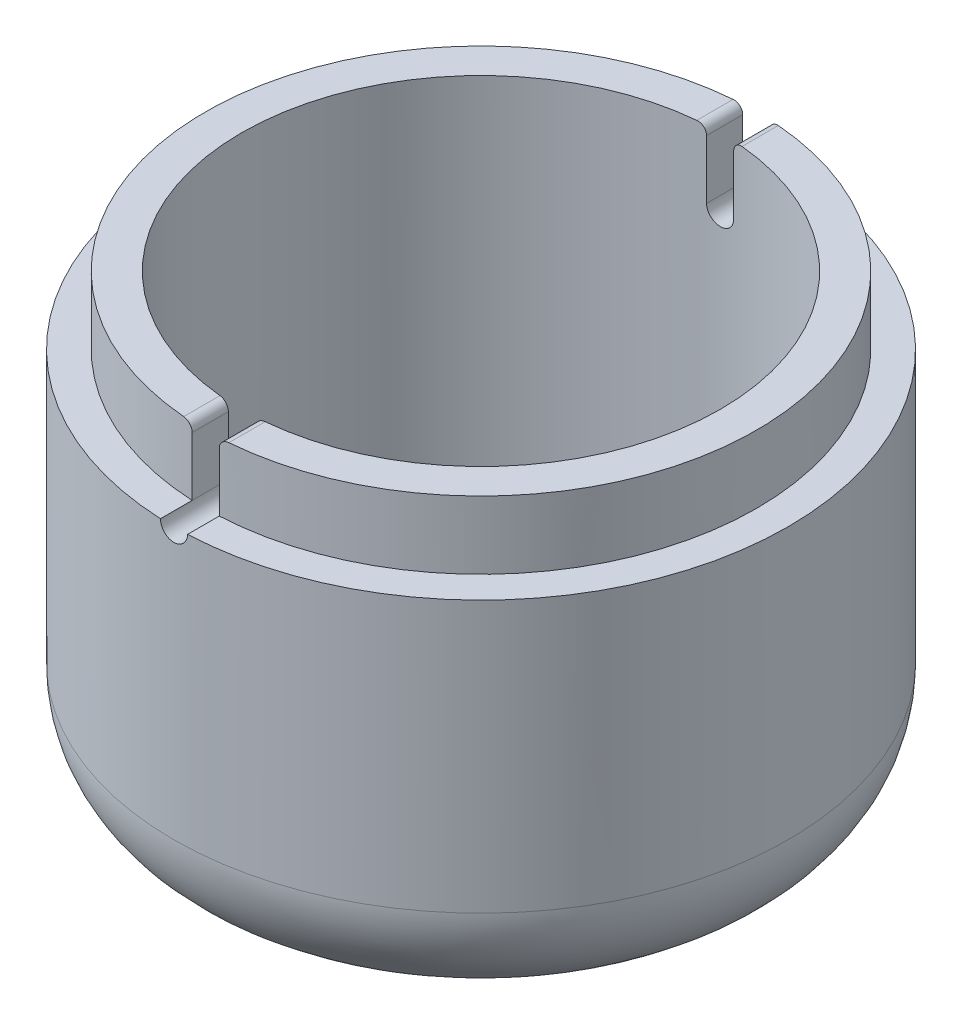
from build123d import *

# Parameters (mm, degrees)
ENL_V_MAT_EXTRU_1_REACH = 66.174
ESQUISSE2_R             = 1.5
ENL_V_MAT_EXTRU_2_DEPTH = 91.720725306
CONG_1_R                = 12
CONG_2_R                = 5
CONG_3_R                = 1


with BuildPart() as part:
    # Esquisse1 → Révolution1 (revolve)
    with BuildSketch(Plane(origin=(0, 0, 0), x_dir=(0, 0, -1), z_dir=(1, 0, 0)), mode=Mode.PRIVATE) as r_volution1_sk:
        Polygon((26.5, 49.5), (26.5, 7), (0, 7), (0, 0), (34, 0), (34, 42), (30.5, 42), (30.5, 49.5), align=None)
    revolve(r_volution1_sk.sketch.rotate(Axis((0, 7, 0), (0, -1, 0)), 180), axis=Axis((0, 7, 0), (0, -1, 0)))

    # Esquisse2 → Enlèv. mat.-Extru.1 (cut, up to next)
    with BuildSketch(Plane(origin=(0, 7, 0), x_dir=(1, 0, 0), z_dir=(0, 1, 0)), mode=Mode.PRIVATE) as enl_v_mat_extru_1_sk1:
        with Locations(Location((0, 0, 0), (0, 0, 270))):
            Circle(ESQUISSE2_R)
    enl_v_mat_extru_1_tool1 = extrude(enl_v_mat_extru_1_sk1.sketch, amount=-ENL_V_MAT_EXTRU_1_REACH, mode=Mode.PRIVATE) & part.part
    # Esquisse2 → Enlèv. mat.-Extru.1 (cut, up to next)
    with BuildSketch(Plane(origin=(0, 7, 0), x_dir=(1, 0, 0), z_dir=(0, 1, 0)), mode=Mode.PRIVATE) as enl_v_mat_extru_1_sk2:
        with Locations(Location((15, 0, 0), (0, 0, 270))):
            Circle(ESQUISSE2_R)
    enl_v_mat_extru_1_tool2 = extrude(enl_v_mat_extru_1_sk2.sketch, amount=-ENL_V_MAT_EXTRU_1_REACH, mode=Mode.PRIVATE) & part.part
    # Esquisse2 → Enlèv. mat.-Extru.1 (cut, up to next)
    with BuildSketch(Plane(origin=(0, 7, 0), x_dir=(1, 0, 0), z_dir=(0, 1, 0)), mode=Mode.PRIVATE) as enl_v_mat_extru_1_sk3:
        with Locations(Location((7.5, -12.990381057, 0), (0, 0, 270))):
            Circle(ESQUISSE2_R)
    enl_v_mat_extru_1_tool3 = extrude(enl_v_mat_extru_1_sk3.sketch, amount=-ENL_V_MAT_EXTRU_1_REACH, mode=Mode.PRIVATE) & part.part
    # Esquisse2 → Enlèv. mat.-Extru.1 (cut, up to next)
    with BuildSketch(Plane(origin=(0, 7, 0), x_dir=(1, 0, 0), z_dir=(0, 1, 0)), mode=Mode.PRIVATE) as enl_v_mat_extru_1_sk4:
        with Locations(Location((-7.5, -12.990381057, 0), (0, 0, 270))):
            Circle(ESQUISSE2_R)
    enl_v_mat_extru_1_tool4 = extrude(enl_v_mat_extru_1_sk4.sketch, amount=-ENL_V_MAT_EXTRU_1_REACH, mode=Mode.PRIVATE) & part.part
    # Esquisse2 → Enlèv. mat.-Extru.1 (cut, up to next)
    with BuildSketch(Plane(origin=(0, 7, 0), x_dir=(1, 0, 0), z_dir=(0, 1, 0)), mode=Mode.PRIVATE) as enl_v_mat_extru_1_sk5:
        with Locations(Location((-15, 0, 0), (0, 0, 270))):
            Circle(ESQUISSE2_R)
    enl_v_mat_extru_1_tool5 = extrude(enl_v_mat_extru_1_sk5.sketch, amount=-ENL_V_MAT_EXTRU_1_REACH, mode=Mode.PRIVATE) & part.part
    # Esquisse2 → Enlèv. mat.-Extru.1 (cut, up to next)
    with BuildSketch(Plane(origin=(0, 7, 0), x_dir=(1, 0, 0), z_dir=(0, 1, 0)), mode=Mode.PRIVATE) as enl_v_mat_extru_1_sk6:
        with Locations(Location((-7.5, 12.990381057, 0), (0, 0, 270))):
            Circle(ESQUISSE2_R)
    enl_v_mat_extru_1_tool6 = extrude(enl_v_mat_extru_1_sk6.sketch, amount=-ENL_V_MAT_EXTRU_1_REACH, mode=Mode.PRIVATE) & part.part
    # Esquisse2 → Enlèv. mat.-Extru.1 (cut, up to next)
    with BuildSketch(Plane(origin=(0, 7, 0), x_dir=(1, 0, 0), z_dir=(0, 1, 0)), mode=Mode.PRIVATE) as enl_v_mat_extru_1_sk7:
        with Locations(Location((7.5, 12.990381057, 0), (0, 0, 270))):
            Circle(ESQUISSE2_R)
    enl_v_mat_extru_1_tool7 = extrude(enl_v_mat_extru_1_sk7.sketch, amount=-ENL_V_MAT_EXTRU_1_REACH, mode=Mode.PRIVATE) & part.part
    add(enl_v_mat_extru_1_tool1.solids().sort_by_distance((0, 7, 0))[0], mode=Mode.SUBTRACT)
    add(enl_v_mat_extru_1_tool2.solids().sort_by_distance((15, 7, 0))[0], mode=Mode.SUBTRACT)
    add(enl_v_mat_extru_1_tool3.solids().sort_by_distance((7.5, 7, 12.990381))[0], mode=Mode.SUBTRACT)
    add(enl_v_mat_extru_1_tool4.solids().sort_by_distance((-7.5, 7, 12.990381))[0], mode=Mode.SUBTRACT)
    add(enl_v_mat_extru_1_tool5.solids().sort_by_distance((-15, 7, 0))[0], mode=Mode.SUBTRACT)
    add(enl_v_mat_extru_1_tool6.solids().sort_by_distance((-7.5, 7, -12.990381))[0], mode=Mode.SUBTRACT)
    add(enl_v_mat_extru_1_tool7.solids().sort_by_distance((7.5, 7, -12.990381))[0], mode=Mode.SUBTRACT)

    # Esquisse3 → Enlèv. mat.-Extru.2 (cut, through all)
    with BuildSketch(Plane.XY.offset(34)):
        with BuildLine():
            Line((-1.5, 42), (-1.5, 49.5))
            Line((-1.5, 49.5), (1.5, 49.5))
            Line((1.5, 49.5), (1.5, 42))
            ThreePointArc((1.5, 42), (0, 40.5), (-1.5, 42))
        make_face()
    extrude(amount=-ENL_V_MAT_EXTRU_2_DEPTH, mode=Mode.SUBTRACT)

    # Congé1
    cong_1_edges = [part.edges().sort_by_distance(p)[0] for p in [
        (0, 0, -34),
    ]]
    fillet(cong_1_edges, radius=CONG_1_R)

    # Congé2
    cong_2_edges = [part.edges().sort_by_distance(p)[0] for p in [
        (0, 7, -26.5),
    ]]
    fillet(cong_2_edges, radius=CONG_2_R)

    # Congé3
    cong_3_edges = [part.edges().sort_by_distance(p)[0] for p in [
        (-1.5, 49.5, -28.460302767),
        (-1.5, 49.5, 28.460302767),
        (1.5, 49.5, -28.460302767),
        (1.5, 49.5, 28.460302767),
    ]]
    fillet(cong_3_edges, radius=CONG_3_R)


solid = part.part
